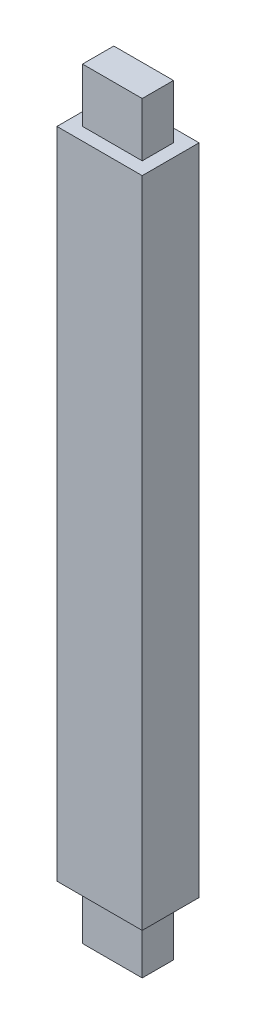
from build123d import *

# Parameters (mm, degrees)
SKETCH1_W           = 15
SKETCH1_H           = 10
BOSS_EXTRUDE1_DEPTH = 57.5
SKETCH2_W           = 10.5
SKETCH2_H           = 5.5
BOSS_EXTRUDE2_DEPTH = 9.5


with BuildPart() as part:
    # Sketch1 → Boss-Extrude1 (new, symmetric)
    with BuildSketch(Plane(origin=(0, 0, 0), x_dir=(1, 0, 0), z_dir=(0, 1, 0))):
        Rectangle(SKETCH1_W, SKETCH1_H)
    extrude(amount=BOSS_EXTRUDE1_DEPTH, both=True)

    # Sketch2 → Boss-Extrude2 (add)
    with BuildSketch(Plane(origin=(0, 57.5, 0), x_dir=(1, 0, 0), z_dir=(0, 1, 0))):
        Rectangle(SKETCH2_W, SKETCH2_H)
    boss_extrude2 = extrude(amount=BOSS_EXTRUDE2_DEPTH)

    # Mirror1: Boss-Extrude2 across plane
    add(boss_extrude2.mirror(Plane.ZX))


solid = part.part
